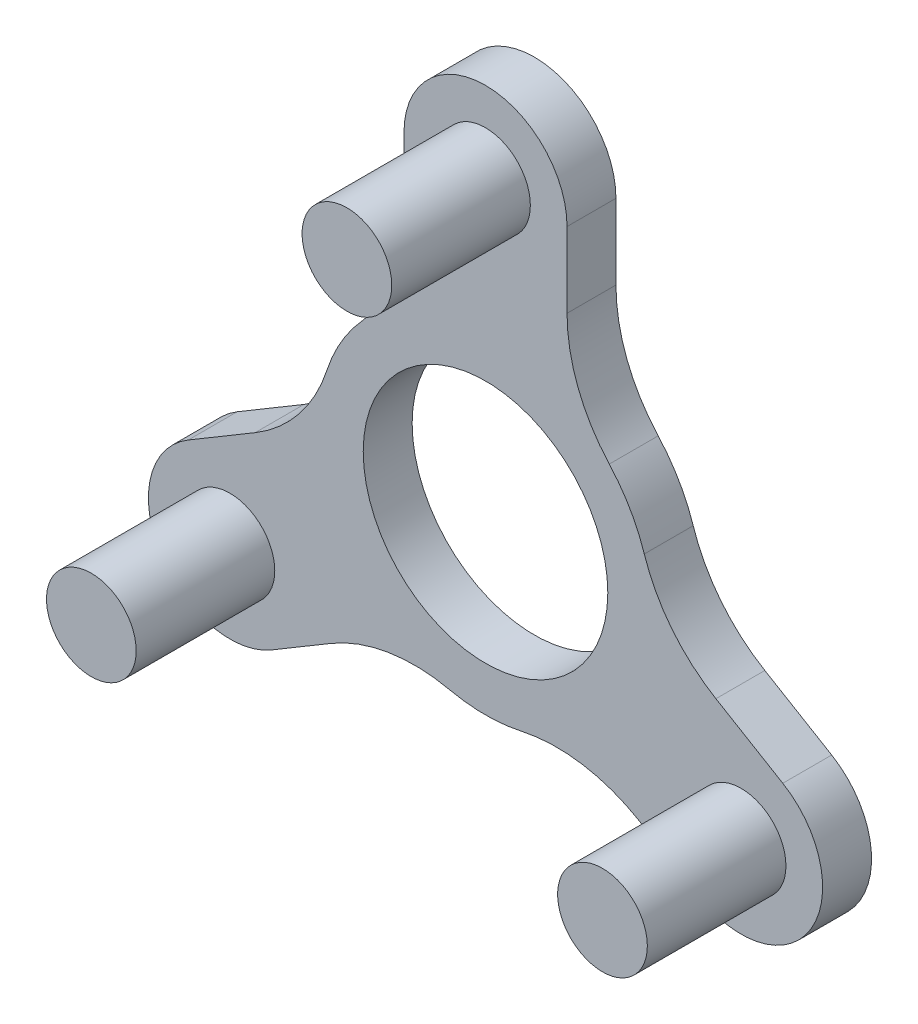
from build123d import *

# Parameters (mm, degrees)
SALIENTE_EXTRUIR1_DEPTH = 3
CROQUIS3_R              = 7.5
CORTAR_EXTRUIR2_DEPTH   = 10
REDONDEO1_R             = 10
CROQUIS2_R              = 2.75
SALIENTE_EXTRUIR2_DEPTH = 8.5


with BuildPart() as part:
    # Croquis1 → Saliente-Extruir1 (new body)
    with BuildSketch(Plane.XY):
        with BuildLine():
            Line((-13.118348224, -13.346885602), (-5.358962429, -8.729934305))
            ThreePointArc((-5.358962429, -8.729934305), (0, -10.243545836), (5.358962429, -8.729934305))
            Line((5.358962429, -8.729934305), (13.118348224, -13.346885602))
            ThreePointArc((13.118348224, -13.346885602), (19.97194541, -11.606711584), (18.231771393, -4.753114398))
            Line((18.231771393, -4.753114398), (10.243545836, 0))
            ThreePointArc((10.243545836, 0), (8.83594818, 5.182301714), (5, 8.94037087))
            Line((5, 8.94037087), (5, 18.2))
            ThreePointArc((5, 18.2), (0, 23.2), (-5, 18.2))
            Line((-5, 18.2), (-5, 8.94037087))
            ThreePointArc((-5, 8.94037087), (-8.83594818, 5.182301714), (-10.243545836, 0))
            Line((-10.243545836, 0), (-18.231771393, -4.753114398))
            ThreePointArc((-18.231771393, -4.753114398), (-19.97194541, -11.606711584), (-13.118348224, -13.346885602))
        make_face()
    extrude(amount=SALIENTE_EXTRUIR1_DEPTH)

    # Croquis3 → Cortar-Extruir2 (cut)
    with BuildSketch(Plane.XY.offset(3)):
        Circle(CROQUIS3_R)
    extrude(amount=-CORTAR_EXTRUIR2_DEPTH, mode=Mode.SUBTRACT)

    # Redondeo1
    redondeo1_edges = [part.edges().sort_by_distance(p)[0] for p in [
        (-10.243545836, 0, 1.5),
        (-5, 8.94037087, 1.5),
        (5, 8.94037087, 1.5),
        (10.243545836, 0, 1.5),
        (5.358962429, -8.729934305, 1.5),
        (-5.358962429, -8.729934305, 1.5),
    ]]
    fillet(redondeo1_edges, radius=REDONDEO1_R)

    # Croquis2 → Saliente-Extruir2 (add)
    with BuildSketch(Plane.XY.offset(3)):
        with Locations((0, 18.2)):
            Circle(CROQUIS2_R)
        with Locations((15.675059808, -9.05)):
            Circle(CROQUIS2_R)
        with Locations((-15.675059808, -9.05)):
            Circle(CROQUIS2_R)
    extrude(amount=SALIENTE_EXTRUIR2_DEPTH)


solid = part.part
